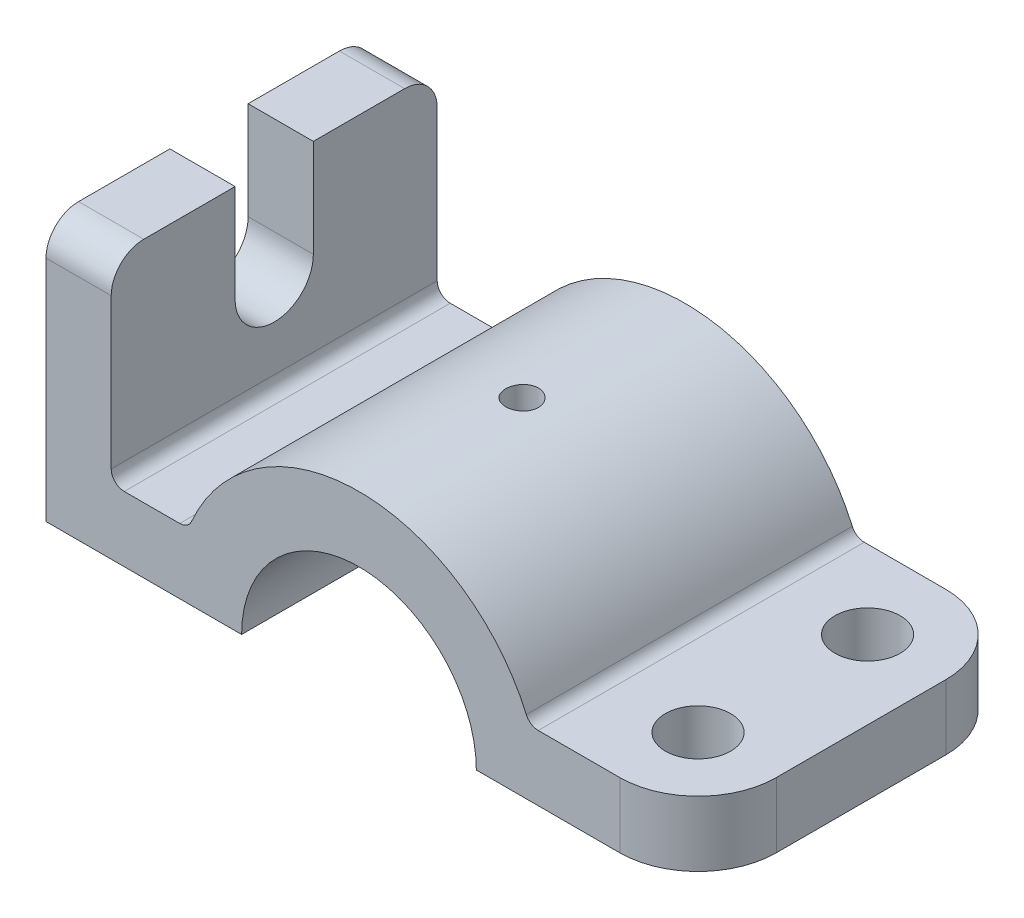
from build123d import *

# Parameters (mm, degrees)
BOSS_EXTRUDE1_DEPTH = 50000
CUT_EXTRUDE1_DEPTH  = 10000
CUT_EXTRUDE2_DEPTH  = 10000
FILLET1_R           = 2000
CUT_EXTRUDE3_DEPTH  = 10000
FILLET2_R           = 2000
SKETCH5_R           = 5000
CUT_EXTRUDE4_DEPTH  = 10000
SKETCH6_R           = 2500
CUT_EXTRUDE5_DEPTH  = 100000


with BuildPart() as part:
    # Sketch1 → Boss-Extrude1 (new body)
    with BuildSketch(Plane.XY):
        with BuildLine():
            Line((18000, 0), (52000, 0))
            Line((52000, 0), (52000, 10000))
            Line((52000, 10000), (26153.393661244, 10000))
            ThreePointArc((26153.393661244, 10000), (0, 28000), (-26153.393661244, 10000))
            Line((-26153.393661244, 10000), (-38000, 10000))
            Line((-38000, 10000), (-38000, 40000))
            Line((-38000, 40000), (-48000, 40000))
            Line((-48000, 40000), (-48000, 0))
            Line((-48000, 0), (-18000, 0))
            ThreePointArc((-18000, 0), (0, 18000), (18000, 0))
        make_face()
    extrude(amount=-BOSS_EXTRUDE1_DEPTH)

    # Sketch2 → Cut-Extrude1 (cut)
    with BuildSketch(Plane.ZY.offset(48000)):
        with BuildLine():
            Line((-50000, 35000), (-50000, 40000))
            Line((-50000, 40000), (-45000, 40000))
            ThreePointArc((-45000, 40000), (-48535.533905933, 38535.533905933), (-50000, 35000))
        make_face()
        with BuildLine():
            Line((0, 35000), (0, 40000))
            Line((0, 40000), (-5000, 40000))
            ThreePointArc((-5000, 40000), (-1464.466094067, 38535.533905933), (0, 35000))
        make_face()
    extrude(amount=-CUT_EXTRUDE1_DEPTH, mode=Mode.SUBTRACT)

    # Sketch3 → Cut-Extrude2 (cut)
    with BuildSketch(Plane.ZY.offset(48000)):
        with BuildLine():
            Line((-31000, 40000), (-19000, 40000))
            Line((-19000, 40000), (-19000, 25000))
            ThreePointArc((-19000, 25000), (-25000, 19000), (-31000, 25000))
            Line((-31000, 25000), (-31000, 40000))
        make_face()
    extrude(amount=-CUT_EXTRUDE2_DEPTH, mode=Mode.SUBTRACT)

    # Fillet1
    fillet1_edges = [part.edges().sort_by_distance(p)[0] for p in [
        (-38000, 10000, -25000),
        (-26153.393661244, 10000, -25000),
    ]]
    fillet(fillet1_edges, radius=FILLET1_R)

    # Sketch4 → Cut-Extrude3 (cut)
    with BuildSketch(Plane(origin=(0, 10000, 0), x_dir=(1, 0, 0), z_dir=(0, 1, 0))):
        with BuildLine():
            Line((52000, 38000), (52000, 50000))
            Line((52000, 50000), (40000, 50000))
            ThreePointArc((40000, 50000), (48485.281374239, 46485.281374239), (52000, 38000))
        make_face()
        with BuildLine():
            Line((52000, 12000), (52000, 0))
            Line((52000, 0), (40000, 0))
            ThreePointArc((40000, 0), (48485.281374239, 3514.718625761), (52000, 12000))
        make_face()
    extrude(amount=-CUT_EXTRUDE3_DEPTH, mode=Mode.SUBTRACT)

    # Fillet2
    fillet2_edges = [part.edges().sort_by_distance(p)[0] for p in [
        (26153.393661244, 10000, -25000),
    ]]
    fillet(fillet2_edges, radius=FILLET2_R)

    # Sketch5 → Cut-Extrude4 (cut)
    with BuildSketch(Plane(origin=(0, 10000, 0), x_dir=(1, 0, 0), z_dir=(0, 1, 0))):
        with Locations(Location((40000, 12000, 0), (0, 0, 270))):
            Circle(SKETCH5_R)
        with Locations(Location((40000, 38000, 0), (0, 0, 270))):
            Circle(SKETCH5_R)
    extrude(amount=-CUT_EXTRUDE4_DEPTH, mode=Mode.SUBTRACT)

    # Sketch6 → Cut-Extrude5 (cut)
    with BuildSketch(Plane(origin=(0, 0, 0), x_dir=(1, 0, 0), z_dir=(0, 1, 0))):
        with Locations(Location((0, 25000, 0), (0, 0, 90))):
            Circle(SKETCH6_R)
    extrude(amount=CUT_EXTRUDE5_DEPTH, mode=Mode.SUBTRACT)


solid = part.part
